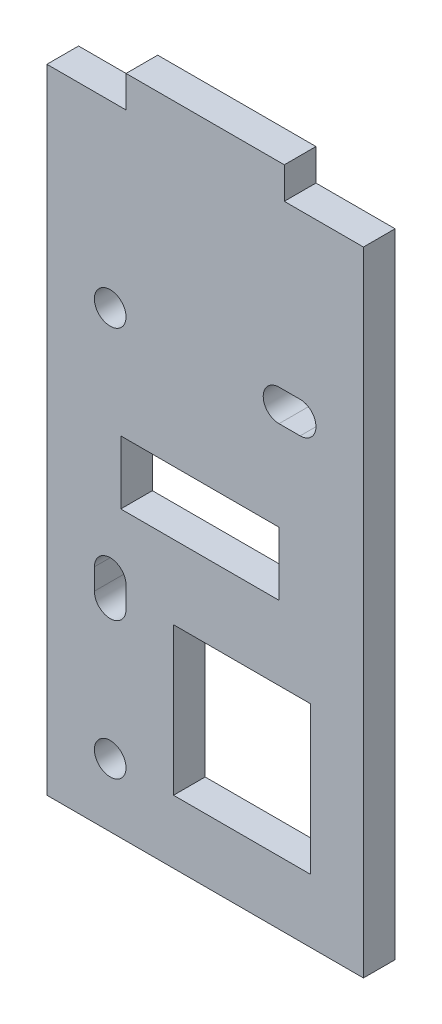
from build123d import *

# Parameters (mm, degrees)
SKETCH1_R           = 1.5
SKETCH1_W           = 13
SKETCH1_H           = 14
SKETCH1_W_2         = 15
SKETCH1_H_2         = 6
BOSS_EXTRUDE1_DEPTH = 3


with BuildPart() as part:
    # Sketch1 → Boss-Extrude1 (new body)
    with BuildSketch(Plane.XY):
        Polygon((0, 0), (30, 0), (30, 60), (22.5, 60), (22.5, 63), (7.5, 63), (7.5, 60), (0, 60), align=None)
        with Locations((6, 6)):
            Circle(SKETCH1_R, mode=Mode.SUBTRACT)
        with Locations((6, 43)):
            Circle(SKETCH1_R, mode=Mode.SUBTRACT)
        with Locations((18.5, 13)):
            Rectangle(SKETCH1_W, SKETCH1_H, mode=Mode.SUBTRACT)
        with Locations((14.5, 30)):
            Rectangle(SKETCH1_W_2, SKETCH1_H_2, mode=Mode.SUBTRACT)
        with BuildLine():
            Line((7.5, 21), (7.5, 19))
            ThreePointArc((7.5, 19), (6, 17.5), (4.5, 19))
            Line((4.5, 19), (4.5, 21))
            ThreePointArc((4.5, 21), (6, 22.5), (7.5, 21))
        make_face(mode=Mode.SUBTRACT)
        with BuildLine():
            Line((22, 44.5), (24, 44.5))
            ThreePointArc((24, 44.5), (25.5, 43), (24, 41.5))
            Line((24, 41.5), (22, 41.5))
            ThreePointArc((22, 41.5), (20.5, 43), (22, 44.5))
        make_face(mode=Mode.SUBTRACT)
    extrude(amount=BOSS_EXTRUDE1_DEPTH)


solid = part.part
